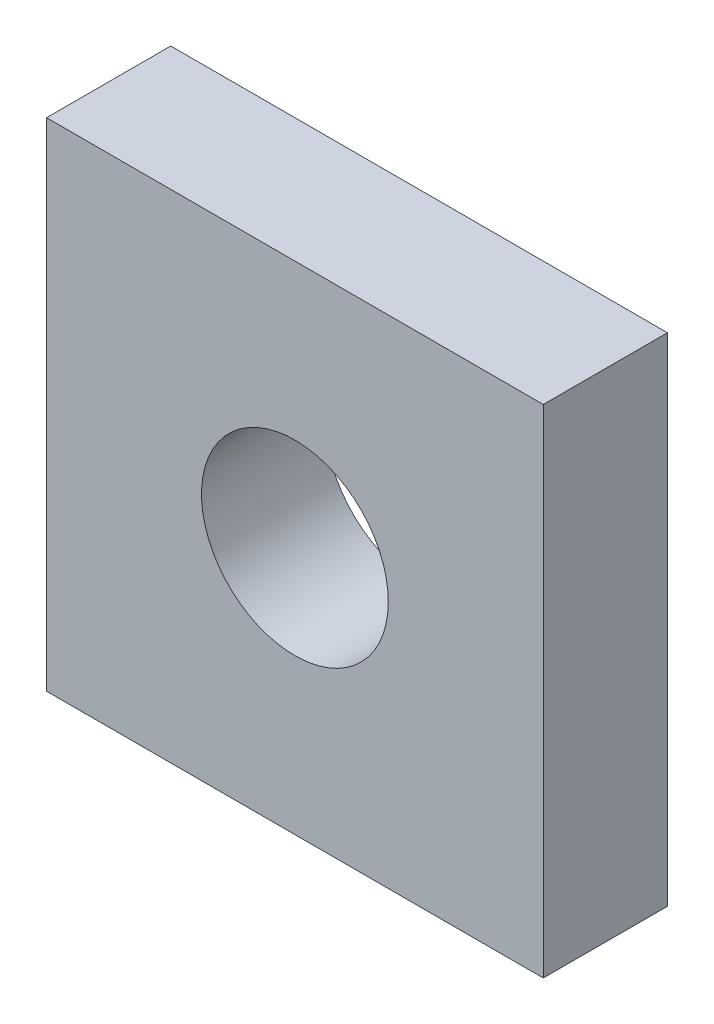
from build123d import *

# Parameters (mm, degrees)
SKETCH1_W           = 25.4
SKETCH1_H           = 25.4
SKETCH1_R           = 4.7752
BOSS_EXTRUDE1_DEPTH = 6.35


with BuildPart() as part:
    # Sketch1 → Boss-Extrude1 (new body)
    with BuildSketch(Plane.XY):
        with Locations((-0.160659769, 6.84139722)):
            Rectangle(SKETCH1_W, SKETCH1_H)
        with Locations((-0.160659769, 6.84139722)):
            Circle(SKETCH1_R, mode=Mode.SUBTRACT)
    extrude(amount=BOSS_EXTRUDE1_DEPTH)


solid = part.part
